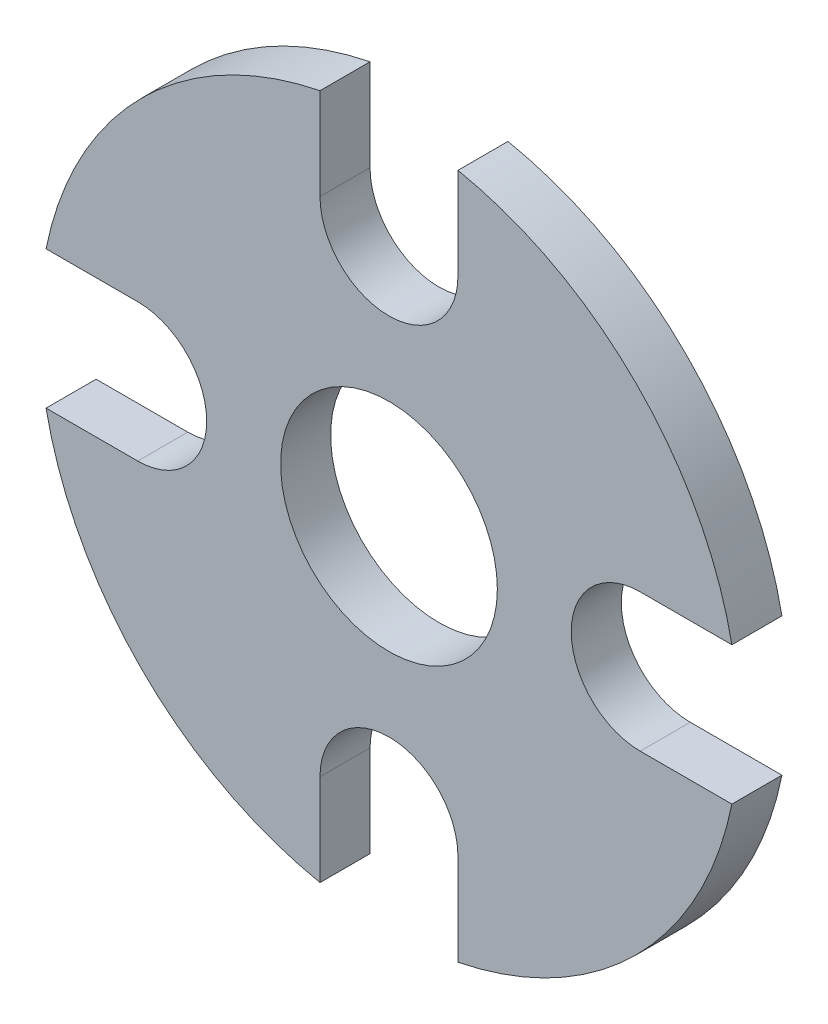
from build123d import *

# Parameters (mm, degrees)
BOSS_EXTRUDE1_DEPTH = 50.8
SKETCH2_R           = 110
CUT_EXTRUDE1_DEPTH  = 495.80363782


with BuildPart() as part:
    # Sketch1 → Boss-Extrude1 (new body)
    with BuildSketch(Plane.XY):
        with BuildLine():
            ThreePointArc((348.030171106, 70), (251.022907321, 251.022907321), (70, 348.030171106))
            Line((70, 348.030171106), (70, 255))
            ThreePointArc((70, 255), (0, 185), (-70, 255))
            Line((-70, 255), (-70, 348.030171106))
            ThreePointArc((-70, 348.030171106), (-251.022907321, 251.022907321), (-348.030171106, 70))
            Line((-348.030171106, 70), (-255, 70))
            ThreePointArc((-255, 70), (-185, 0), (-255, -70))
            Line((-255, -70), (-348.030171106, -70))
            ThreePointArc((-348.030171106, -70), (-251.022907321, -251.022907321), (-70, -348.030171106))
            Line((-70, -348.030171106), (-70, -255))
            ThreePointArc((-70, -255), (0, -185), (70, -255))
            Line((70, -255), (70, -348.030171106))
            ThreePointArc((70, -348.030171106), (251.022907321, -251.022907321), (348.030171106, -70))
            Line((348.030171106, -70), (255, -70))
            ThreePointArc((255, -70), (185, 0), (255, 70))
            Line((255, 70), (348.030171106, 70))
        make_face()
    extrude(amount=BOSS_EXTRUDE1_DEPTH)

    # Sketch2 → Cut-Extrude1 (cut, through all)
    with BuildSketch(Plane.XY.offset(50.8)):
        Circle(SKETCH2_R)
    extrude(amount=-CUT_EXTRUDE1_DEPTH, mode=Mode.SUBTRACT)


solid = part.part
